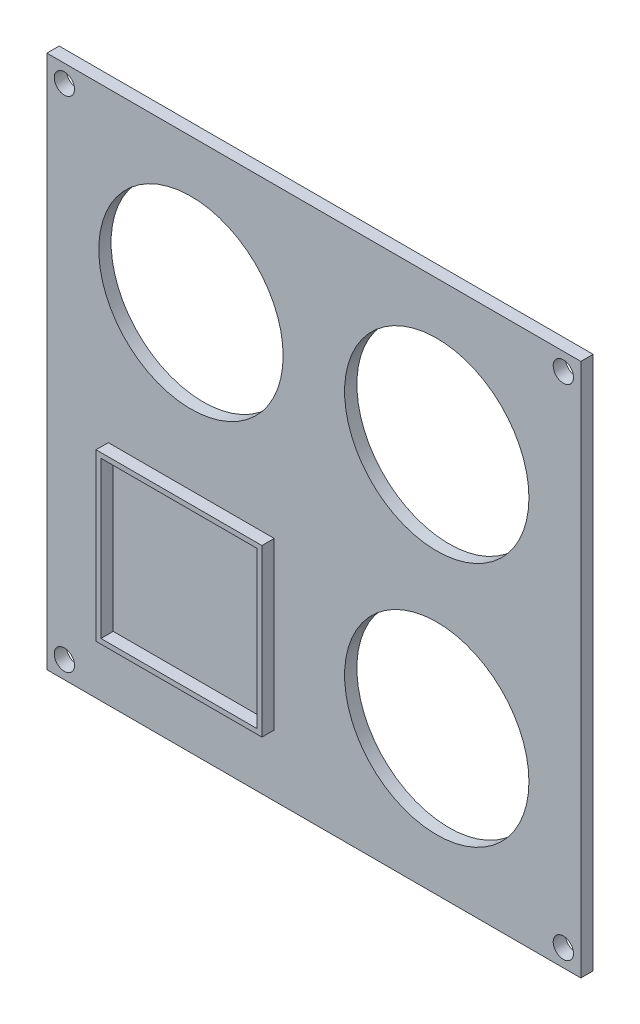
from build123d import *

# Parameters (mm, degrees)
SKETCH1_W           = 86.9
SKETCH1_H           = 86.9
BOSS_EXTRUDE1_DEPTH = 2
SKETCH2_R           = 1.65
CUT_EXTRUDE3_DEPTH  = 123.911431527
SKETCH3_W           = 27
SKETCH3_H           = 27
BOSS_EXTRUDE2_DEPTH = 2
SKETCH4_W           = 25.4
SKETCH4_H           = 25.4
CUT_EXTRUDE4_DEPTH  = 2
SKETCH5_R           = 15
CUT_EXTRUDE5_DEPTH  = 2


with BuildPart() as part:
    # Sketch1 → Boss-Extrude1 (new body)
    with BuildSketch(Plane(origin=(0, 0, 0), x_dir=(0, 1, 0), z_dir=(0, 0, 1))):
        with Locations((43.45, 43.45)):
            Rectangle(SKETCH1_W, SKETCH1_H)
    extrude(amount=BOSS_EXTRUDE1_DEPTH)

    # Sketch2 → Cut-Extrude3 (cut, through all)
    with BuildSketch(Plane.XY.offset(2)):
        with Locations((-84.05, 2.85)):
            Circle(SKETCH2_R)
        with Locations((-2.85, 2.85)):
            Circle(SKETCH2_R)
        with Locations((-2.85, 84.05)):
            Circle(SKETCH2_R)
        with Locations((-84.05, 84.05)):
            Circle(SKETCH2_R)
    extrude(amount=-CUT_EXTRUDE3_DEPTH, mode=Mode.SUBTRACT)

    # Sketch3 → Boss-Extrude2 (add)
    with BuildSketch(Plane.XY.offset(2)):
        with Locations((-63.4, 23.5)):
            Rectangle(SKETCH3_W, SKETCH3_H)
    extrude(amount=BOSS_EXTRUDE2_DEPTH)

    # Sketch4 → Cut-Extrude4 (cut)
    with BuildSketch(Plane.XY.offset(4)):
        with Locations((-63.4, 23.5)):
            Rectangle(SKETCH4_W, SKETCH4_H)
    extrude(amount=-CUT_EXTRUDE4_DEPTH, mode=Mode.SUBTRACT)

    # Sketch5 → Cut-Extrude5 (cut)
    with BuildSketch(Plane.XY.offset(2)):
        with Locations((-63.45, 63.45)):
            Circle(SKETCH5_R)
        with Locations((-23.45, 63.45)):
            Circle(SKETCH5_R)
        with Locations((-23.45, 23.45)):
            Circle(SKETCH5_R)
    extrude(amount=-CUT_EXTRUDE5_DEPTH, mode=Mode.SUBTRACT)


solid = part.part
